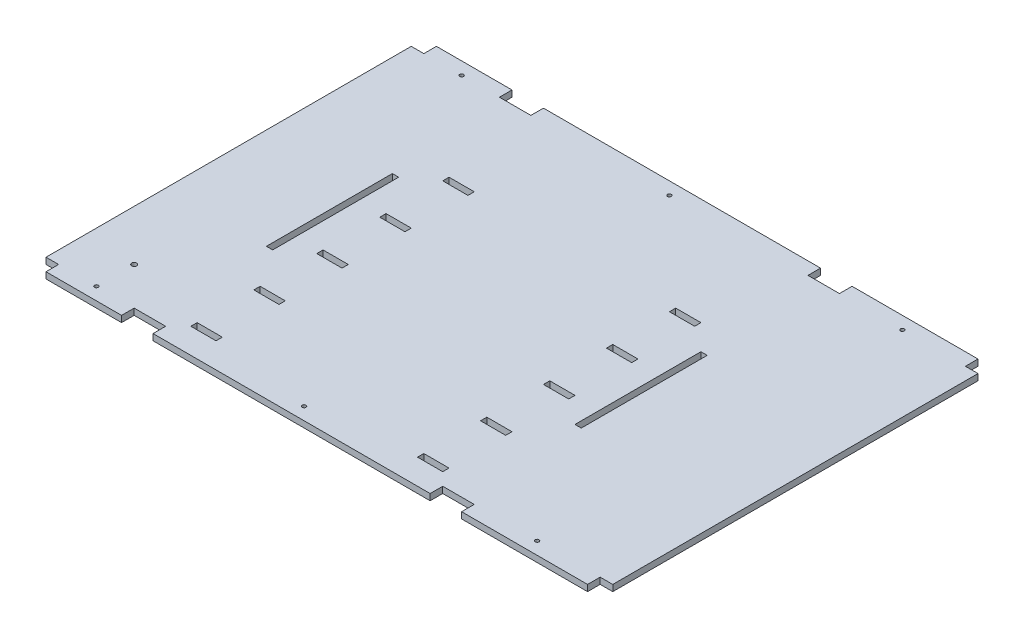
from build123d import *

# Parameters (mm, degrees)
SKIZZE1_W                       = 450
SKIZZE1_H                       = 310
AUFSATZ_LINEAR_AUSTRAGEN1_DEPTH = 5
SKIZZE2_W                       = 10
SKIZZE2_H                       = 10
SKIZZE2_W_2                     = 25
SCHNITT_LINEAR_AUSTRAGEN1_DEPTH = 547.465918425
SKIZZE3_W                       = 5
SKIZZE3_H                       = 100
SCHNITT_LINEAR_AUSTRAGEN2_DEPTH = 547.465918425
SKIZZE4_W                       = 20
SKIZZE4_H                       = 5
SCHNITT_LINEAR_AUSTRAGEN3_DEPTH = 547.465918425
SKIZZE5_R                       = 1.5
SCHNITT_LINEAR_AUSTRAGEN4_DEPTH = 547.465918425
SKIZZE6_R                       = 2
SCHNITT_LINEAR_AUSTRAGEN5_DEPTH = 547.465918425


with BuildPart() as part:
    # Skizze1 → Aufsatz-Linear austragen1 (new body)
    with BuildSketch(Plane(origin=(0, 0, 0), x_dir=(1, 0, 0), z_dir=(0, 1, 0))):
        with Locations((225, -155)):
            Rectangle(SKIZZE1_W, SKIZZE1_H)
    extrude(amount=AUFSATZ_LINEAR_AUSTRAGEN1_DEPTH)

    # Skizze2 → Schnitt-Linear austragen1 (cut, through all)
    with BuildSketch(Plane(origin=(0, 5, 0), x_dir=(1, 0, 0), z_dir=(0, 1, 0))):
        with Locations((5, -5)):
            Rectangle(SKIZZE2_W, SKIZZE2_H)
        with Locations((445, -305)):
            Rectangle(SKIZZE2_W, SKIZZE2_H)
        with Locations((445, -5)):
            Rectangle(SKIZZE2_W, SKIZZE2_H)
        with Locations((5, -305)):
            Rectangle(SKIZZE2_W, SKIZZE2_H)
        with Locations((82.5, -5)):
            Rectangle(SKIZZE2_W_2, SKIZZE2_H)
        with Locations((327.5, -5)):
            Rectangle(SKIZZE2_W_2, SKIZZE2_H)
        with Locations((327.5, -305)):
            Rectangle(SKIZZE2_W_2, SKIZZE2_H)
        with Locations((82.5, -305)):
            Rectangle(SKIZZE2_W_2, SKIZZE2_H)
    extrude(amount=-SCHNITT_LINEAR_AUSTRAGEN1_DEPTH, mode=Mode.SUBTRACT)

    # Skizze3 → Schnitt-Linear austragen2 (cut, through all)
    with BuildSketch(Plane(origin=(0, 5, 0), x_dir=(1, 0, 0), z_dir=(0, 1, 0))):
        with Locations((82.5, -155)):
            Rectangle(SKIZZE3_W, SKIZZE3_H)
        with Locations((327.5, -155)):
            Rectangle(SKIZZE3_W, SKIZZE3_H)
    extrude(amount=-SCHNITT_LINEAR_AUSTRAGEN2_DEPTH, mode=Mode.SUBTRACT)

    # Skizze4 → Schnitt-Linear austragen3 (cut, through all)
    with BuildSketch(Plane(origin=(0, 5, 0), x_dir=(1, 0, 0), z_dir=(0, 1, 0))):
        with Locations((115, -287.5)):
            Rectangle(SKIZZE4_W, SKIZZE4_H)
        with Locations((295, -287.5)):
            Rectangle(SKIZZE4_W, SKIZZE4_H)
        with Locations((115, -237.5)):
            Rectangle(SKIZZE4_W, SKIZZE4_H)
        with Locations((115, -187.5)):
            Rectangle(SKIZZE4_W, SKIZZE4_H)
        with Locations((115, -137.5)):
            Rectangle(SKIZZE4_W, SKIZZE4_H)
        with Locations((115, -87.5)):
            Rectangle(SKIZZE4_W, SKIZZE4_H)
        with Locations((295, -237.5)):
            Rectangle(SKIZZE4_W, SKIZZE4_H)
        with Locations((295, -187.5)):
            Rectangle(SKIZZE4_W, SKIZZE4_H)
        with Locations((295, -137.5)):
            Rectangle(SKIZZE4_W, SKIZZE4_H)
        with Locations((295, -87.5)):
            Rectangle(SKIZZE4_W, SKIZZE4_H)
    extrude(amount=-SCHNITT_LINEAR_AUSTRAGEN3_DEPTH, mode=Mode.SUBTRACT)

    # Skizze5 → Schnitt-Linear austragen4 (cut, through all)
    with BuildSketch(Plane(origin=(0, 5, 0), x_dir=(1, 0, 0), z_dir=(0, 1, 0))):
        with Locations(Location((40, -10, 0), (0, 0, 270))):
            Circle(SKIZZE5_R)
        with Locations(Location((205, -10, 0), (0, 0, 270))):
            Circle(SKIZZE5_R)
        with Locations(Location((390, -10, 0), (0, 0, 270))):
            Circle(SKIZZE5_R)
        with Locations(Location((40, -300, 0), (0, 0, 270))):
            Circle(SKIZZE5_R)
        with Locations(Location((205, -300, 0), (0, 0, 270))):
            Circle(SKIZZE5_R)
        with Locations(Location((390, -300, 0), (0, 0, 270))):
            Circle(SKIZZE5_R)
    extrude(amount=-SCHNITT_LINEAR_AUSTRAGEN4_DEPTH, mode=Mode.SUBTRACT)

    # Skizze6 → Schnitt-Linear austragen5 (cut, through all)
    with BuildSketch(Plane(origin=(0, 5, 0), x_dir=(1, 0, 0), z_dir=(0, 1, 0))):
        with Locations(Location((40, -270, 0), (0, 0, 270))):
            Circle(SKIZZE6_R)
    extrude(amount=-SCHNITT_LINEAR_AUSTRAGEN5_DEPTH, mode=Mode.SUBTRACT)


solid = part.part
